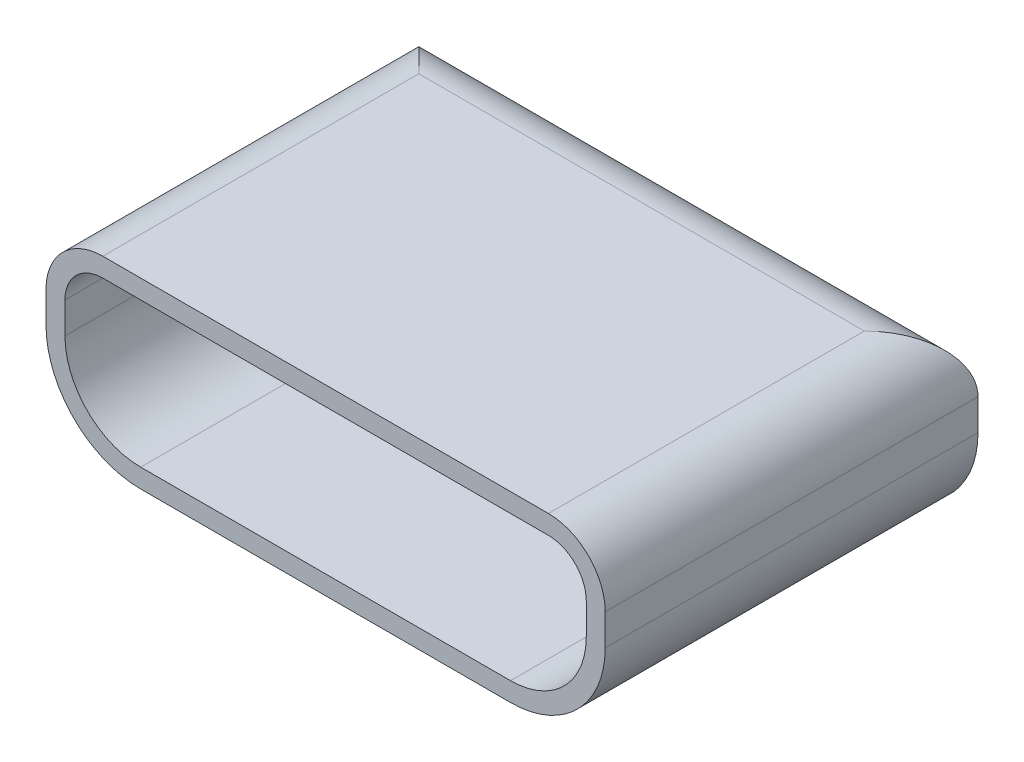
from build123d import *

# Parameters (mm, degrees)
SKETCH1_W           = 7.5
SKETCH1_H           = 2.45
BOSS_EXTRUDE1_DEPTH = 5
FILLET1_R           = 0.762
FILLET2_R           = 1.27
CUT_EXTRUDE1_DEPTH  = 4


with BuildPart() as part:
    # Sketch1 → Boss-Extrude1 (new body)
    with BuildSketch(Plane.XY):
        Rectangle(SKETCH1_W, SKETCH1_H)
    extrude(amount=BOSS_EXTRUDE1_DEPTH)

    # Fillet1
    fillet1_edges = [part.edges().sort_by_distance(p)[0] for p in [
        (0, 1.225, 0),
        (-3.75, 1.225, 2.5),
        (3.75, 1.225, 2.5),
    ]]
    fillet(fillet1_edges, radius=FILLET1_R)

    # Fillet2
    fillet2_edges = [part.edges().sort_by_distance(p)[0] for p in [
        (3.75, -1.225, 2.5),
        (-3.75, -1.225, 2.5),
    ]]
    fillet(fillet2_edges, radius=FILLET2_R)

    # Sketch2 → Cut-Extrude1 (cut)
    with BuildSketch(Plane.XY.offset(5)):
        with BuildLine():
            Line((3.496, 0.045), (3.496, 0.463))
            ThreePointArc((3.496, 0.463), (3.347210245, 0.822210245), (2.988, 0.971))
            Line((2.988, 0.971), (-2.988, 0.971))
            ThreePointArc((-2.988, 0.971), (-3.347210245, 0.822210245), (-3.496, 0.463))
            Line((-3.496, 0.463), (-3.496, 0.045))
            ThreePointArc((-3.496, 0.045), (-3.19842049, -0.67342049), (-2.48, -0.971))
            Line((-2.48, -0.971), (2.48, -0.971))
            ThreePointArc((2.48, -0.971), (3.19842049, -0.67342049), (3.496, 0.045))
        make_face()
    extrude(amount=-CUT_EXTRUDE1_DEPTH, mode=Mode.SUBTRACT)


solid = part.part
